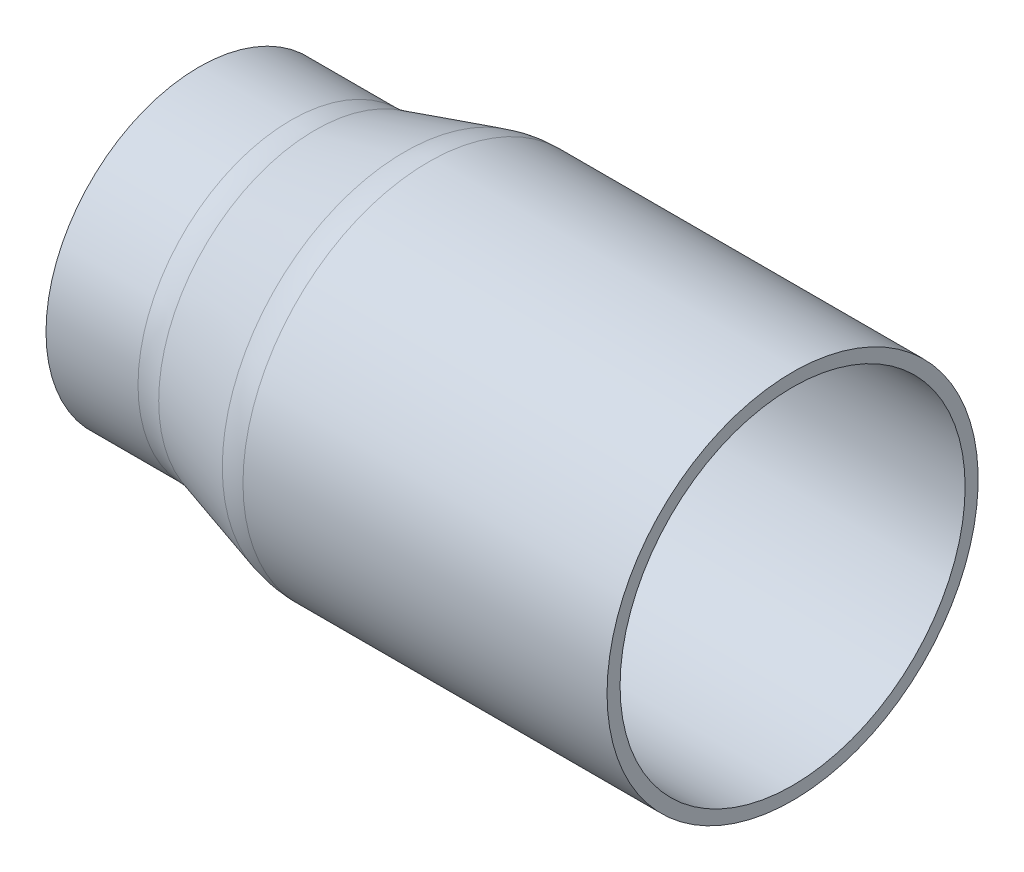
from build123d import *


with BuildPart() as part:
    # Sketch1 → Revolve1 (revolve)
    with BuildSketch(Plane(origin=(0, 0, 0), x_dir=(1, 0, 0), z_dir=(0, 1, 0)), mode=Mode.PRIVATE) as revolve1_sk:
        with BuildLine():
            Line((-64.453003754, 16.1), (-53.866494762, 16.1))
            ThreePointArc((-53.866494762, 16.1), (-52.466916096, 16.1984254), (-51.094888249, 16.491764088))
            Line((-51.094888249, 16.491764088), (-40.81111926, 19.458235912))
            ThreePointArc((-40.81111926, 19.458235912), (-39.439091413, 19.7515746), (-38.039512747, 19.85))
            Line((-38.039512747, 19.85), (3.846996246, 19.85))
            Line((3.846996246, 19.85), (3.846996246, 21.35))
            Line((3.846996246, 21.35), (-38.039512747, 21.35))
            ThreePointArc((-38.039512747, 21.35), (-39.439091413, 21.2515746), (-40.81111926, 20.958235912))
            Line((-40.81111926, 20.958235912), (-51.094888249, 17.991764088))
            ThreePointArc((-51.094888249, 17.991764088), (-52.466916096, 17.6984254), (-53.866494762, 17.6))
            Line((-53.866494762, 17.6), (-64.453003754, 17.6))
            Line((-64.453003754, 17.6), (-64.453003754, 16.1))
        make_face()
    revolve(revolve1_sk.sketch.rotate(Axis((-73.729430683, 0, 0), (1, 0, 0)), 180), axis=Axis((-73.729430683, 0, 0), (1, 0, 0)))


solid = part.part
